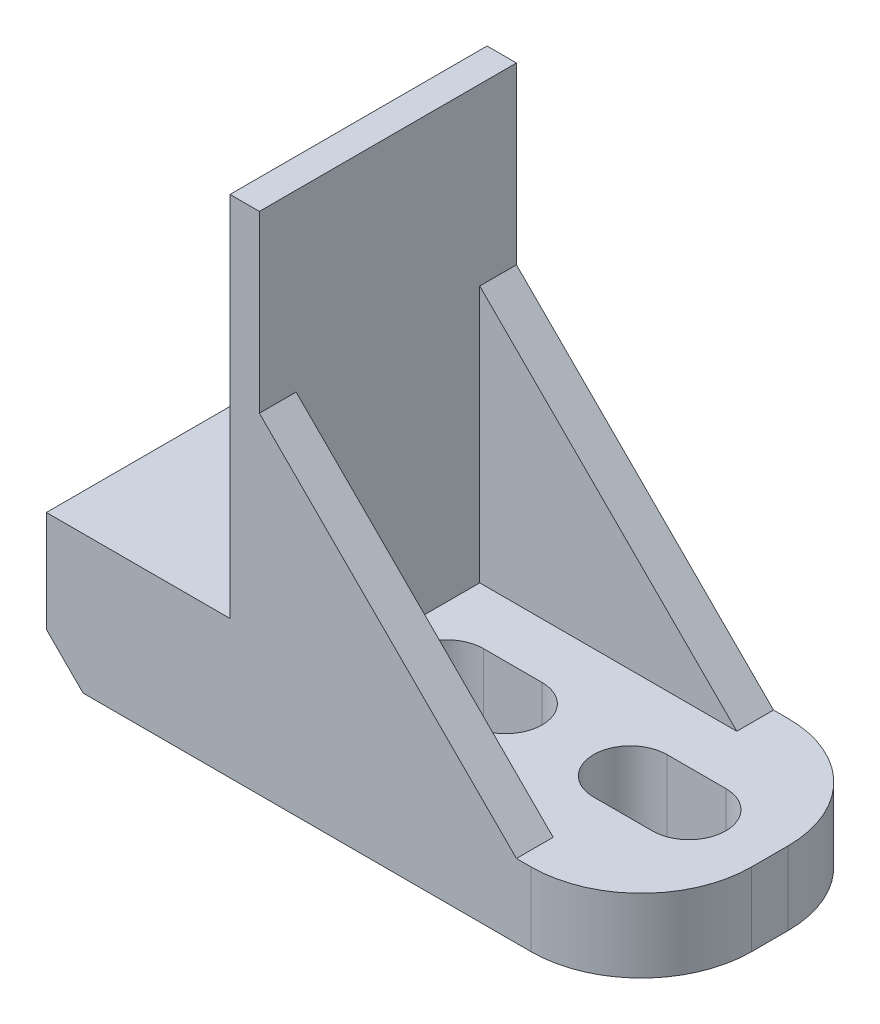
from build123d import *

# Parameters (mm, degrees)
BOSS_EXTRUDE1_DEPTH = 35
BOSS_EXTRUDE2_DEPTH = 5
BOSS_EXTRUDE3_START = 35
BOSS_EXTRUDE3_DEPTH = 5
CUT_EXTRUDE1_DEPTH  = 137.38179019
CHAMFER1_SIZE       = 5
FILLET1_R           = 15


with BuildPart() as part:
    # Sketch1 → Boss-Extrude1 (new body)
    with BuildSketch(Plane.XY):
        Polygon((-41.540540541, -20.232432432), (-122.540540541, -20.232432432), (-122.540540541, -1.432432432), (-97.540540541, -1.432432432), (-97.540540541, 48.567567568), (-93.540540541, 48.567567568), (-93.540540541, -10.232432432), (-41.540540541, -10.232432432), align=None)
    extrude(amount=BOSS_EXTRUDE1_DEPTH)

    # Sketch3 → Boss-Extrude2 (add)
    with BuildSketch(Plane.XY):
        Polygon((-93.540540541, 24.767567568), (-93.540540541, -10.232432432), (-58.540540541, -10.232432432), align=None)
    extrude(amount=BOSS_EXTRUDE2_DEPTH)

    # Sketch3<2> → Boss-Extrude3 (add)
    with BuildSketch(Plane.XY.offset(BOSS_EXTRUDE3_START)):
        Polygon((-93.540540541, 24.767567568), (-93.540540541, -10.232432432), (-58.540540541, -10.232432432), align=None)
    extrude(amount=-BOSS_EXTRUDE3_DEPTH)

    # Sketch2 → Cut-Extrude1 (cut, through all)
    with BuildSketch(Plane(origin=(0, 0, 0), x_dir=(1, 0, 0), z_dir=(0, 1, 0))):
        with BuildLine():
            Line((-85.540540541, -12.5), (-77.540540541, -12.5))
            ThreePointArc((-77.540540541, -12.5), (-72.540540541, -17.5), (-77.540540541, -22.5))
            Line((-77.540540541, -22.5), (-85.540540541, -22.5))
            ThreePointArc((-85.540540541, -22.5), (-90.540540541, -17.5), (-85.540540541, -12.5))
        make_face()
        with BuildLine():
            Line((-60.540540541, -12.5), (-52.540540541, -12.5))
            ThreePointArc((-52.540540541, -12.5), (-47.540540541, -17.5), (-52.540540541, -22.5))
            Line((-52.540540541, -22.5), (-60.540540541, -22.5))
            ThreePointArc((-60.540540541, -22.5), (-65.540540541, -17.5), (-60.540540541, -12.5))
        make_face()
    extrude(amount=-CUT_EXTRUDE1_DEPTH, mode=Mode.SUBTRACT)

    # Chamfer1
    chamfer1_edges = [part.edges().sort_by_distance(p)[0] for p in [
        (-122.540540541, -20.232432432, 17.5),
    ]]
    chamfer(chamfer1_edges, length=CHAMFER1_SIZE)

    # Fillet1
    fillet1_edges = [part.edges().sort_by_distance(p)[0] for p in [
        (-41.540540541, -15.232432432, 0),
        (-41.540540541, -15.232432432, 35),
    ]]
    fillet(fillet1_edges, radius=FILLET1_R)


solid = part.part
